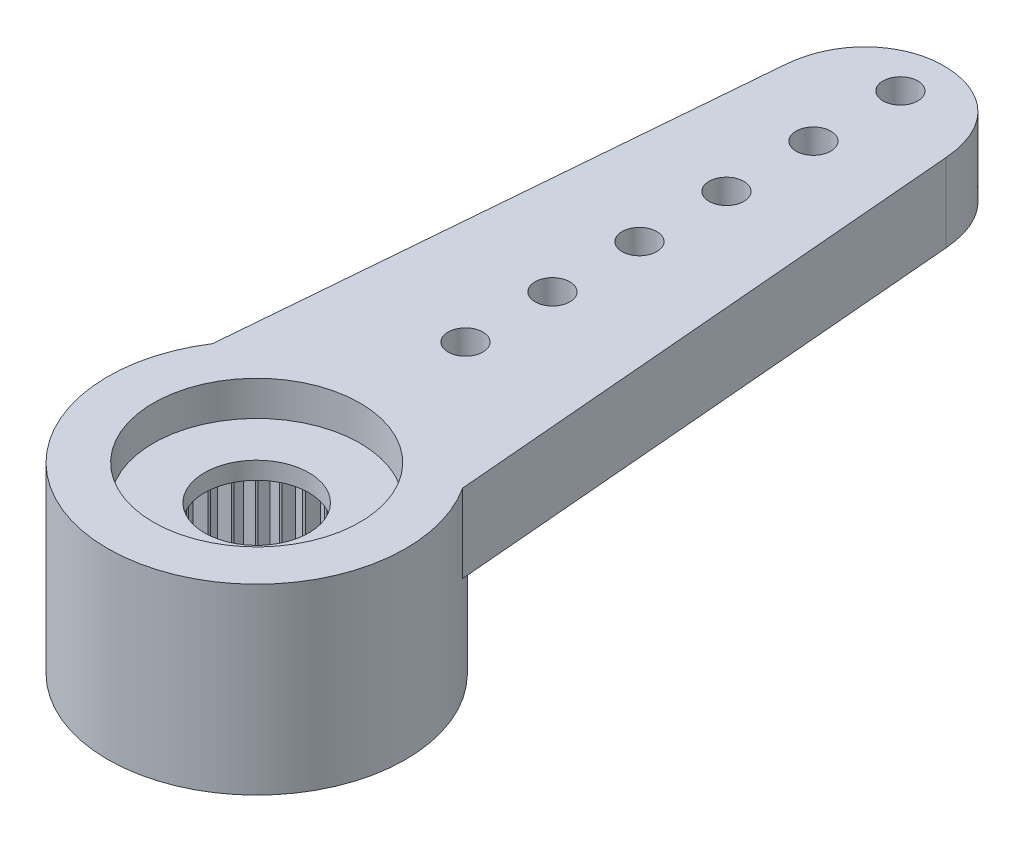
from build123d import *

# Parameters (mm, degrees)
SKETCH1_R           = 3.425
HUB_DEPTH           = 2.4
SKETCH2_R           = 0.4
BOSS_EXTRUDE2_DEPTH = 1.8
SKETCH3_R           = 2.375
CUT_EXTRUDE1_DEPTH  = 0.8
SKETCH4_R           = 1.2
CUT_EXTRUDE2_DEPTH  = 17.520612
CUT_EXTRUDE3_DEPTH  = 3
CIRPATTERN1_COUNT   = 36
SKETCH6_R           = 2.25
CUT_EXTRUDE4_DEPTH  = 3


with BuildPart() as part:
    # Sketch1 → HUB (new body)
    with BuildSketch(Plane(origin=(0, 0, 0), x_dir=(1, 0, 0), z_dir=(0, 1, 0))):
        with Locations(Location((0, 0, 0), (0, 0, 270))):
            Circle(SKETCH1_R)
    extrude(amount=HUB_DEPTH)

    # Sketch2 → Boss-Extrude2 (add)
    with BuildSketch(Plane(origin=(0, 2.4, 0), x_dir=(1, 0, 0), z_dir=(0, 1, 0))):
        with BuildLine():
            Line((-2.875, 1.861451), (-1.85, 14))
            add(Edge.make_bspline(
                [(-1.85, 14), (-1.761904, 15.043277), (-0.882336, 15.809649), (0.882387, 15.802355), (1.755744, 15.11622), (1.85, 14)],
                knots=[0, 0, 0, 0, 0.45, 0.55, 1, 1, 1, 1], degree=3))
            Line((1.85, 14), (2.875, 1.861451))
            ThreePointArc((2.875, 1.861451), (0, -3.425), (-2.875, 1.861451))
        make_face()
        with Locations(Location((0, 14.8, 0), (0, 0, 270))):
            Circle(SKETCH2_R, mode=Mode.SUBTRACT)
        with Locations(Location((0, 12.8, 0), (0, 0, 270))):
            Circle(SKETCH2_R, mode=Mode.SUBTRACT)
        with Locations(Location((0, 10.8, 0), (0, 0, 270))):
            Circle(SKETCH2_R, mode=Mode.SUBTRACT)
        with Locations(Location((0, 8.8, 0), (0, 0, 270))):
            Circle(SKETCH2_R, mode=Mode.SUBTRACT)
        with Locations(Location((0, 6.8, 0), (0, 0, 270))):
            Circle(SKETCH2_R, mode=Mode.SUBTRACT)
        with Locations(Location((0, 4.8, 0), (0, 0, 270))):
            Circle(SKETCH2_R, mode=Mode.SUBTRACT)
    extrude(amount=BOSS_EXTRUDE2_DEPTH)

    # Sketch3 → Cut-Extrude1 (cut)
    with BuildSketch(Plane(origin=(0, 4.2, 0), x_dir=(1, 0, 0), z_dir=(0, 1, 0))):
        with Locations(Location((0, 0, 0), (0, 0, 270))):
            Circle(SKETCH3_R)
    extrude(amount=-CUT_EXTRUDE1_DEPTH, mode=Mode.SUBTRACT)

    # Sketch4 → Cut-Extrude2 (cut, through all)
    with BuildSketch(Plane(origin=(0, 3.4, 0), x_dir=(1, 0, 0), z_dir=(0, 1, 0))):
        with Locations(Location((0, 0, 0), (0, 0, 270))):
            Circle(SKETCH4_R)
    extrude(amount=-CUT_EXTRUDE2_DEPTH, mode=Mode.SUBTRACT)

    # Sketch5 → Cut-Extrude3 (cut)
    with BuildSketch(Plane.XZ):
        with BuildLine():
            Line((0, 2.45), (-0.173437, 2.243305))
            ThreePointArc((-0.173437, 2.243305), (0, 2.25), (0.173437, 2.243305))
            Line((0.173437, 2.243305), (0, 2.45))
        make_face()
    cut_extrude3 = extrude(amount=-CUT_EXTRUDE3_DEPTH, mode=Mode.SUBTRACT)

    # CirPattern1: Cut-Extrude3 ×36 about axis
    cirpattern1_axis = Axis((0, 0, 0), (0, 1, 0))
    for i in range(1, CIRPATTERN1_COUNT):
        add(cut_extrude3.rotate(cirpattern1_axis, i * 360 / CIRPATTERN1_COUNT), mode=Mode.SUBTRACT)

    # Sketch6 → Cut-Extrude4 (cut)
    with BuildSketch(Plane.XZ):
        Circle(SKETCH6_R)
    extrude(amount=-CUT_EXTRUDE4_DEPTH, mode=Mode.SUBTRACT)


solid = part.part
